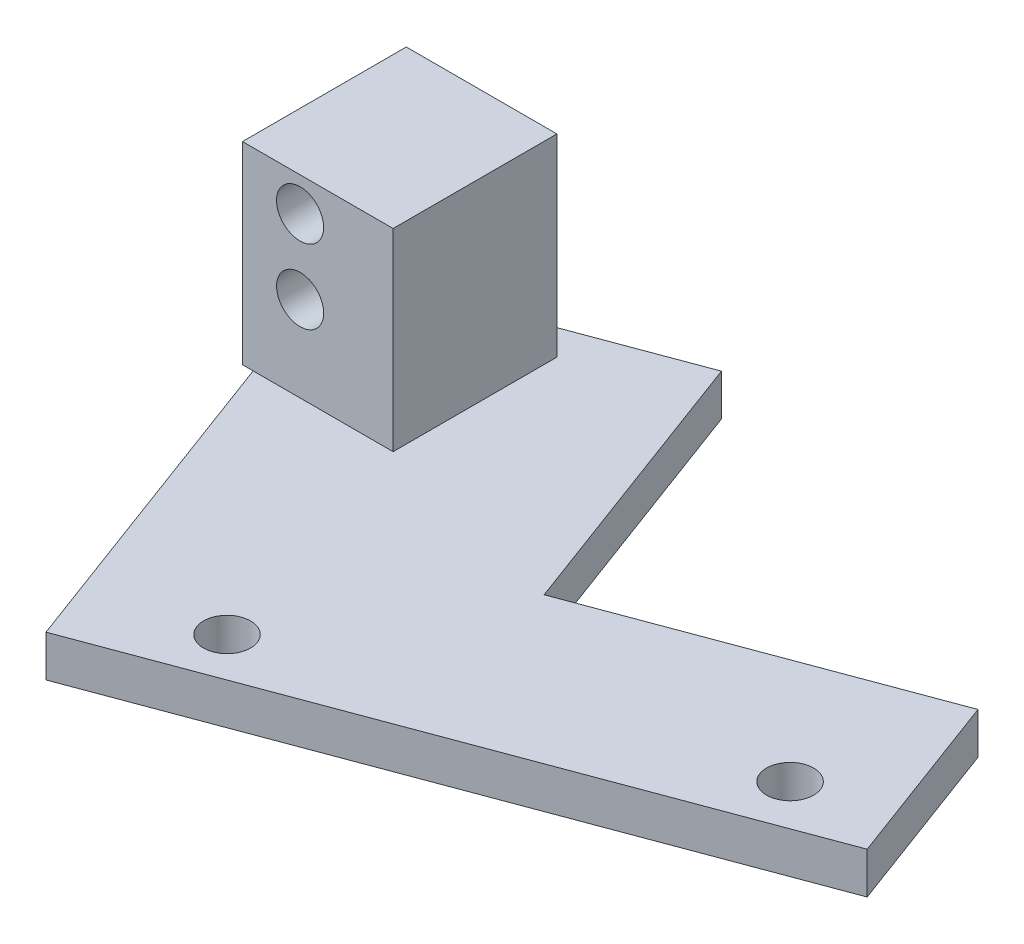
from build123d import *

# Parameters (mm, degrees)
SKETCH1_W           = 20.32
SKETCH1_H           = 26.081708108
SKETCH1_R           = 3.175
BOSS_EXTRUDE1_DEPTH = 22.098
SKETCH2_R           = 3.175
BOSS_EXTRUDE2_DEPTH = 5.588


with BuildPart() as part:
    # Sketch1 → Boss-Extrude1 (new body)
    with BuildSketch(Plane.XY):
        with Locations((-101.659894533, 115.530854428)):
            Rectangle(SKETCH1_W, SKETCH1_H)
        with Locations(Location((-104.05047074, 124, 0), (0, 0, 180))):
            Circle(SKETCH1_R, mode=Mode.SUBTRACT)
        with Locations(Location((-104.04520642, 114, 0), (0, 0, 180))):
            Circle(SKETCH1_R, mode=Mode.SUBTRACT)
    extrude(amount=BOSS_EXTRUDE1_DEPTH)

    # Sketch2 → Boss-Extrude2 (add)
    with BuildSketch(Plane(origin=(0, 102.490000374, 0), x_dir=(1, 0, 0), z_dir=(0, 1, 0))):
        Polygon((-93.832652136, -66.597718767), (-13.072372895, -36.5640681), (-21.925888481, -12.757025827), (-64.594900087, -28.625051556), (-78.760525025, 9.46621608), (-116.851792661, -4.699408859), align=None)
        with Locations(Location((-81.347326341, -54.659995843, 0), (0, 0, 270))):
            Circle(SKETCH2_R, mode=Mode.SUBTRACT)
        with Locations(Location((-26.172504674, -33.862735355, 0), (0, 0, 270))):
            Circle(SKETCH2_R, mode=Mode.SUBTRACT)
    extrude(amount=-BOSS_EXTRUDE2_DEPTH)


solid = part.part
